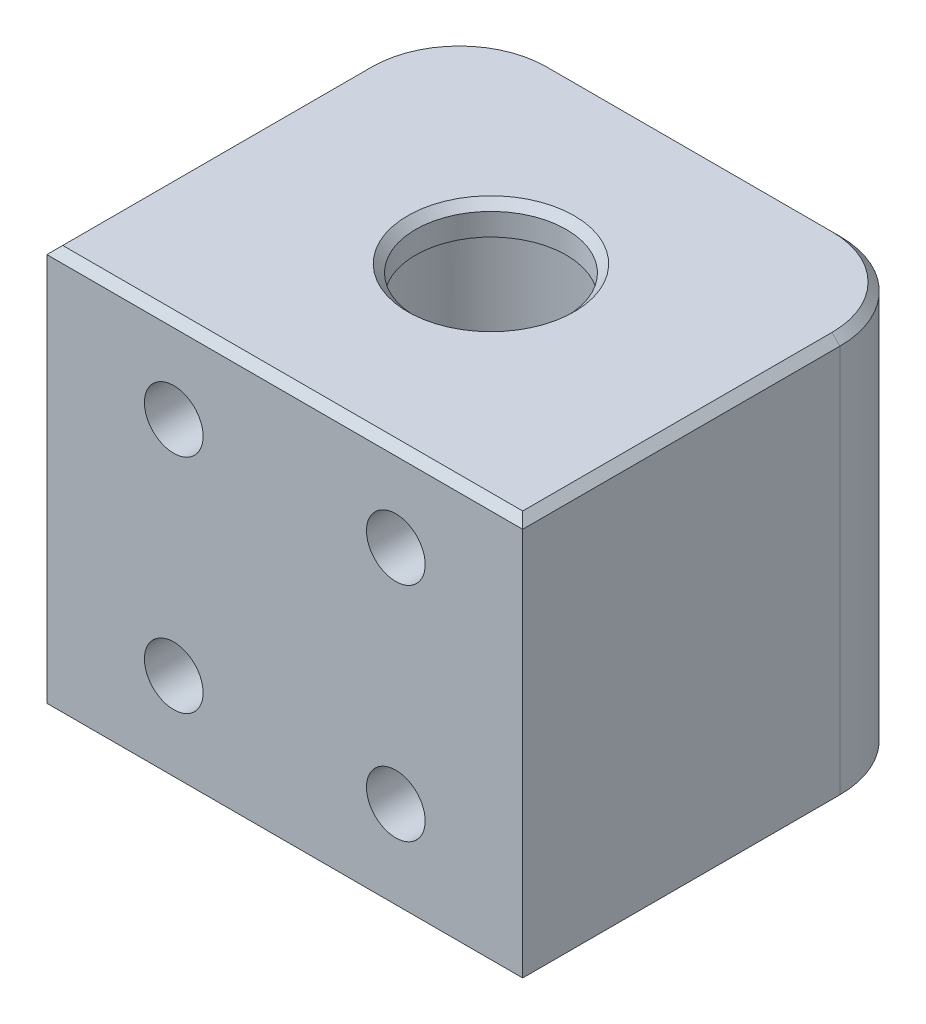
from build123d import *

# Parameters (mm, degrees)
SKETCH1_W                      = 30
SKETCH1_H                      = 26
BOSS_EXTRUDE1_DEPTH            = 25
CUT_EXTRUDE3_DEPTH             = 3.5
F_3_7_3_7_DIAMETER_HOLE1_D     = 3.7
F_3_7_3_7_DIAMETER_HOLE1_DEPTH = 4
F_3_7_3_7_DIAMETER_HOLE1_TIP   = 1.111592145
F_2_7_2_7_DIAMETER_HOLE3_D     = 2.7
F_2_7_2_7_DIAMETER_HOLE3_DEPTH = 12
F_2_7_2_7_DIAMETER_HOLE3_TIP   = 0.811161836
FILLET1_R                      = 6
CHAMFER1_SIZE                  = 0.5


with BuildPart() as part:
    # Sketch1 → Boss-Extrude1 (new body)
    with BuildSketch(Plane(origin=(0, 0, 0), x_dir=(1, 0, 0), z_dir=(0, 1, 0))):
        Rectangle(SKETCH1_W, SKETCH1_H)
    extrude(amount=BOSS_EXTRUDE1_DEPTH)

    # Sketch12 → Cut-Extrude3 (cut)
    with BuildSketch(Plane.XZ):
        with BuildLine():
            Line((13.059862174, 6.3), (-13.059862174, 6.3))
            ThreePointArc((-13.059862174, 6.3), (-14.5, 0), (-13.059862174, -6.3))
            Line((-13.059862174, -6.3), (13.059862174, -6.3))
            ThreePointArc((13.059862174, -6.3), (14.5, 0), (13.059862174, 6.3))
        make_face()
    extrude(amount=-CUT_EXTRUDE3_DEPTH, mode=Mode.SUBTRACT)

    # Ø3.7 (3.7) Diameter Hole1
    with Locations(Plane.XY.offset(13)):
        with Locations((7, 5.5), (7, 19.5), (-7, 5.5), (-7, 19.5)):
            Hole(F_3_7_3_7_DIAMETER_HOLE1_D / 2, depth=F_3_7_3_7_DIAMETER_HOLE1_DEPTH)
            with Locations((0, 0, -(F_3_7_3_7_DIAMETER_HOLE1_DEPTH + F_3_7_3_7_DIAMETER_HOLE1_TIP / 2))):  # 118° drill point
                Cone(0, F_3_7_3_7_DIAMETER_HOLE1_D / 2, F_3_7_3_7_DIAMETER_HOLE1_TIP, mode=Mode.SUBTRACT)

    # Sketch13 → Cut-Revolve2 (revolve, cut)
    with BuildSketch(Plane.XY, mode=Mode.PRIVATE) as cut_revolve2_sk:
        Polygon((-6.6, 0), (-6.6, 23.1), (-4.75, 23.1), (-4.75, 25), (0, 25), (0, 0), align=None)
    revolve(cut_revolve2_sk.sketch.rotate(Axis((0, 0, 0), (0, 1, 0)), 270), axis=Axis((0, 0, 0), (0, 1, 0)), mode=Mode.SUBTRACT)

    # Ø2.7 (2.7) Diameter Hole3
    with Locations(Plane.XZ.offset(-3.5)):
        with Locations((-9.25, 0), (9.25, 0)):
            Hole(F_2_7_2_7_DIAMETER_HOLE3_D / 2, depth=F_2_7_2_7_DIAMETER_HOLE3_DEPTH)
            with Locations((0, 0, -(F_2_7_2_7_DIAMETER_HOLE3_DEPTH + F_2_7_2_7_DIAMETER_HOLE3_TIP / 2))):  # 118° drill point
                Cone(0, F_2_7_2_7_DIAMETER_HOLE3_D / 2, F_2_7_2_7_DIAMETER_HOLE3_TIP, mode=Mode.SUBTRACT)

    # Fillet1
    fillet1_edges = [part.edges().sort_by_distance(p)[0] for p in [
        (-15, 12.5, -13),
        (15, 12.5, -13),
    ]]
    fillet(fillet1_edges, radius=FILLET1_R)

    # Chamfer1
    chamfer1_edges = [part.edges().sort_by_distance(p)[0] for p in [
        (15, 25, 3),
        (0, 25, 4.75),
        (0, 25, -13),
        (-15, 25, 3),
        (-13.242640687, 25, -11.242640687),
        (13.242640687, 25, -11.242640687),
        (0, 25, 13),
    ]]
    chamfer(chamfer1_edges, length=CHAMFER1_SIZE)


solid = part.part
